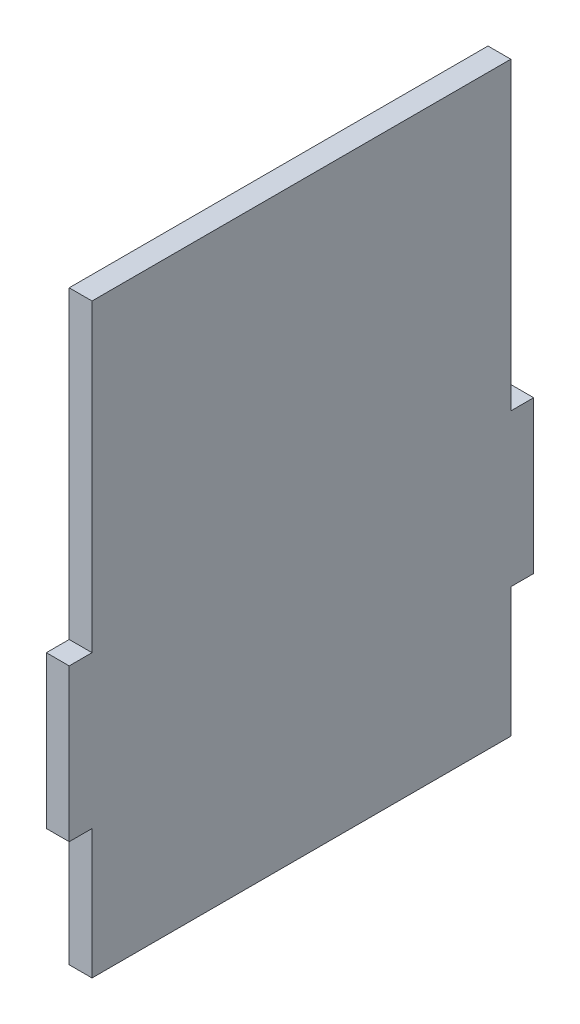
from build123d import *

# Parameters (mm, degrees)
BOSS_EXTRUDE1_DEPTH = 3


with BuildPart() as part:
    # Sketch1 → Boss-Extrude1 (new body)
    with BuildSketch(Plane(origin=(0, 0, 0), x_dir=(0, 0, -1), z_dir=(1, 0, 0))):
        Polygon((-27.5, 0), (27.5, 0), (27.5, 17), (30.5, 17), (30.5, 37), (27.5, 37), (27.5, 77), (-27.5, 77), (-27.5, 37), (-30.5, 37), (-30.5, 17), (-27.5, 17), align=None)
    extrude(amount=BOSS_EXTRUDE1_DEPTH)


solid = part.part
